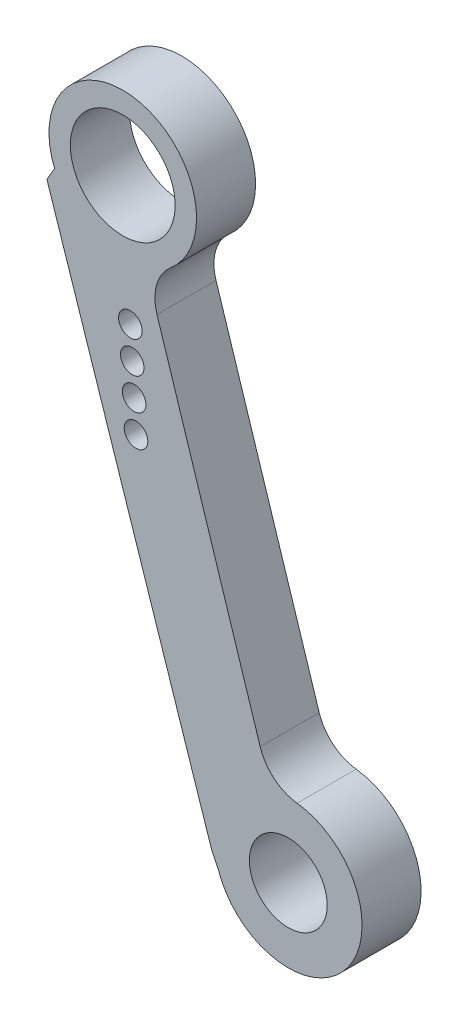
from build123d import *

# Parameters (mm, degrees)
SKETCH1_R           = 2.6375
SKETCH1_R_2         = 3.55
SKETCH1_R_3         = 0.8
BOSS_EXTRUDE1_DEPTH = 4


with BuildPart() as part:
    # Sketch1 → Boss-Extrude1 (new body)
    with BuildSketch(Plane.XY.offset(4)):
        with BuildLine():
            Line((4.361186649, 84.509770663), (3.838692378, 83.622901822))
            Line((3.838692378, 83.622901822), (15.011053362, 49.830662375))
            Line((15.011053362, 49.830662375), (15.45509163, 48.928599175))
            ThreePointArc((15.45509163, 48.928599175), (24.07294723, 47.365734356), (20.790472779, 55.485792426))
            ThreePointArc((20.790472779, 55.485792426), (19.237477826, 56.151424967), (18.290512878, 57.550752445))
            Line((18.290512878, 57.550752445), (11.299825408, 79.414245507))
            ThreePointArc((11.299825408, 79.414245507), (11.27305415, 81.153168904), (12.215576399, 82.614751297))
            ThreePointArc((12.215576399, 82.614751297), (10.152046635, 91.286695043), (4.361186649, 84.509770663))
        make_face()
        with Locations(Location((20.194596002, 50.521426317, 0), (0, 0, 180))):
            Circle(SKETCH1_R, mode=Mode.SUBTRACT)
        with Locations(Location((8.979351439, 86.426161535, 0), (0, 0, 180))):
            Circle(SKETCH1_R_2, mode=Mode.SUBTRACT)
        with Locations(Location((9.4943608, 77.941777919, 0), (0, 0, 180))):
            Circle(SKETCH1_R_3, mode=Mode.SUBTRACT)
        with Locations(Location((9.621598406, 75.845636084, 0), (0, 0, 180))):
            Circle(SKETCH1_R_3, mode=Mode.SUBTRACT)
        with Locations(Location((9.748836013, 73.749494249, 0), (0, 0, 180))):
            Circle(SKETCH1_R_3, mode=Mode.SUBTRACT)
        with Locations(Location((9.87607362, 71.653352414, 0), (0, 0, 180))):
            Circle(SKETCH1_R_3, mode=Mode.SUBTRACT)
    extrude(amount=-BOSS_EXTRUDE1_DEPTH)


solid = part.part
